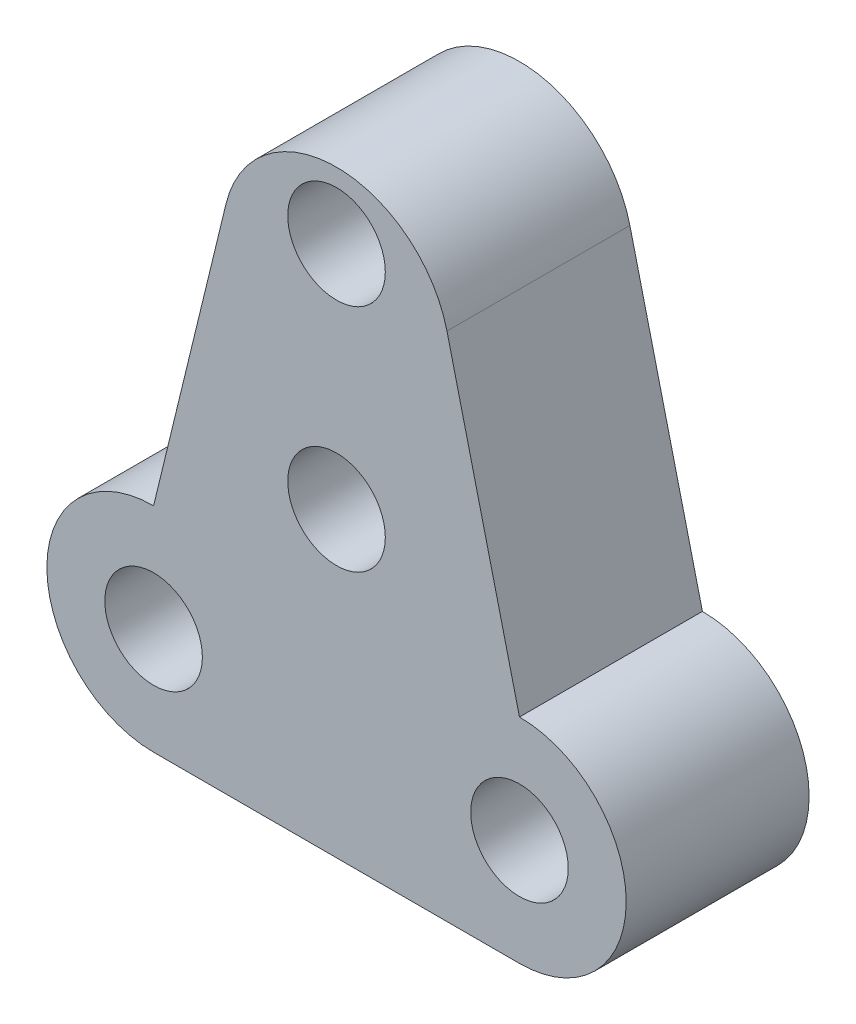
from build123d import *

# Parameters (mm, degrees)
CROQUIS1_R              = 1.6
SALIENTE_EXTRUIR1_DEPTH = 6
REDONDEO1_R             = 3.727663


with BuildPart() as part:
    # Croquis1 → Saliente-Extruir1 (new body)
    with BuildSketch(Plane.XY):
        with BuildLine():
            Line((-6, 0), (6, 0))
            ThreePointArc((6, 0), (9.5, 3.5), (6, 7))
            Line((6, 7), (4, 15.22))
            Line((4, 15.22), (2.929440389, 19.62))
            Line((2.929440389, 19.62), (-2.929440389, 19.62))
            Line((-2.929440389, 19.62), (-4, 15.22))
            Line((-4, 15.22), (-6, 7))
            ThreePointArc((-6, 7), (-9.5, 3.5), (-6, 0))
        make_face()
        with Locations((6, 3.5)):
            Circle(CROQUIS1_R, mode=Mode.SUBTRACT)
        with Locations((-6, 3.5)):
            Circle(CROQUIS1_R, mode=Mode.SUBTRACT)
        with Locations((0, 17.44)):
            Circle(CROQUIS1_R, mode=Mode.SUBTRACT)
        with Locations((0, 9.9)):
            Circle(CROQUIS1_R, mode=Mode.SUBTRACT)
    extrude(amount=SALIENTE_EXTRUIR1_DEPTH)

    # Redondeo1
    redondeo1_edges = [part.edges().sort_by_distance(p)[0] for p in [
        (-2.929440389, 19.62, 3),
        (2.929440389, 19.62, 3),
    ]]
    fillet(redondeo1_edges, radius=REDONDEO1_R)


solid = part.part
